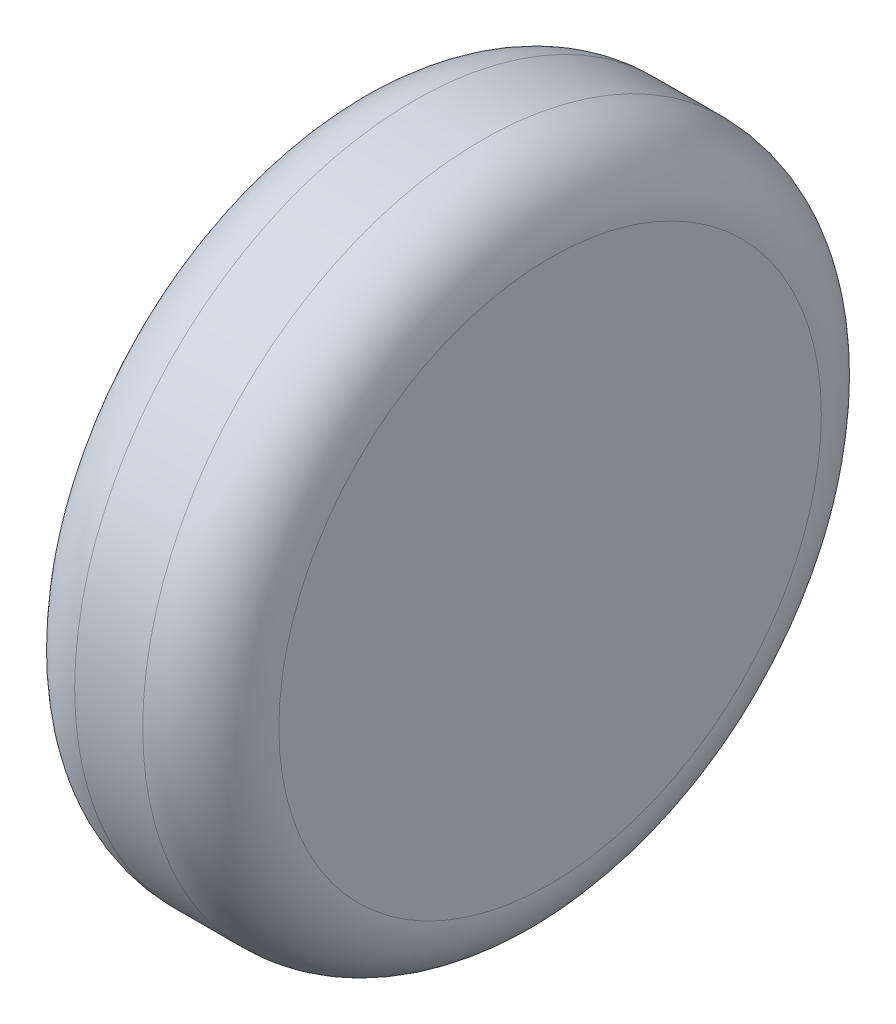
from build123d import *

# Parameters (mm, degrees)
SKETCH1_R           = 63.2968
BOSS_EXTRUDE1_DEPTH = 38.1
FILLET1_R           = 12.7


with BuildPart() as part:
    # Sketch1 → Boss-Extrude1 (new body)
    with BuildSketch(Plane(origin=(0, 0, 0), x_dir=(0, 0, -1), z_dir=(1, 0, 0))):
        with Locations(Location((0, 0, 0), (0, 0, 180))):
            Circle(SKETCH1_R)
    extrude(amount=BOSS_EXTRUDE1_DEPTH)

    # Fillet1
    fillet1_edges = [part.edges().sort_by_distance(p)[0] for p in [
        (0, 0, -63.2968),
        (38.1, 0, -63.2968),
    ]]
    fillet(fillet1_edges, radius=FILLET1_R)


solid = part.part
